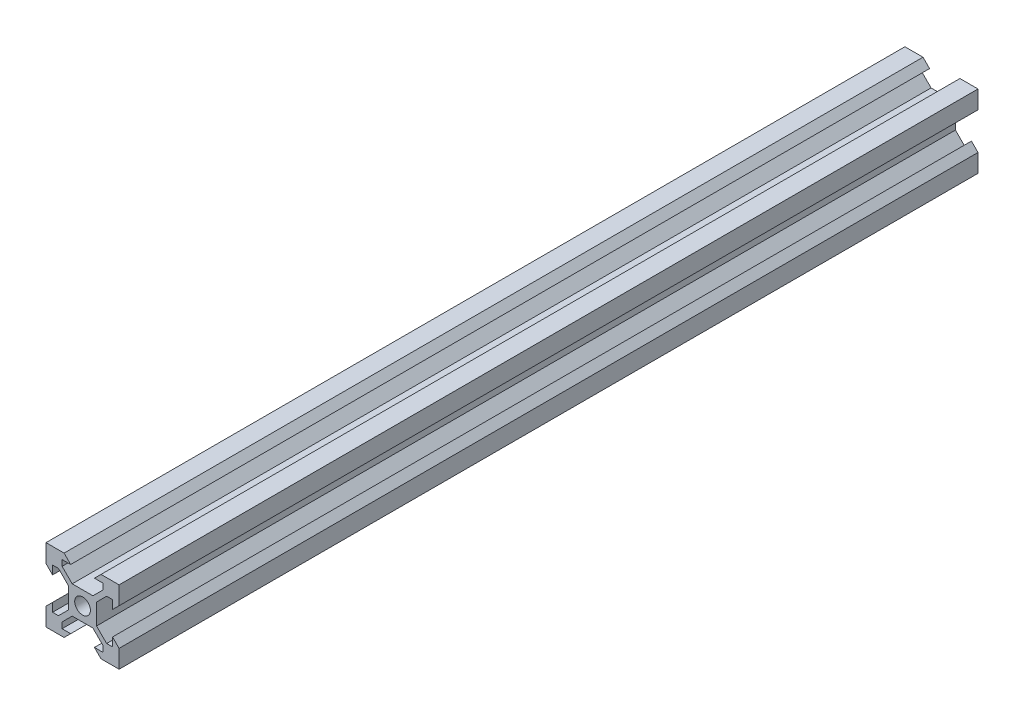
from build123d import *

# Parameters (mm, degrees)
CROQUIS1_R      = 2.15
BOSCHBASE_DEPTH = 235


with BuildPart() as part:
    # Croquis1 → BoschBase (new body)
    with BuildSketch(Plane.XY):
        Polygon((4.4, 0), (0, 0), (0, -0.56736664), (0, -4.4), (0, -4.95), (1.8, -6.75), (1.8, -4.4), (3.410050506, -4.4), (6.175, -7.164949494), (6.175, -12.835050506), (3.410050506, -15.6), (1.8, -15.6), (1.8, -13.25), (0, -15.05), (0, -15.6), (0, -20), (4.4, -20), (4.95, -20), (6.75, -18.2), (4.4, -18.2), (4.4, -16.589949494), (7.164949494, -13.825), (12.835050506, -13.825), (15.6, -16.589949494), (15.6, -18.2), (13.25, -18.2), (15.05, -20), (15.6, -20), (18.2, -20), (20, -20), (20, -15.6), (20, -15.05), (18.2, -13.25), (18.2, -15.6), (16.589949494, -15.6), (13.825, -12.835050506), (13.825, -7.164949494), (16.589949494, -4.4), (18.2, -4.4), (18.2, -6.75), (20, -4.95), (20, -4.4), (20, 0), (15.6, 0), (15.05, 0), (13.25, -1.8), (15.6, -1.8), (15.6, -3.410050506), (12.835050506, -6.175), (7.164949494, -6.175), (4.4, -3.410050506), (4.4, -1.8), (6.75, -1.8), (4.95, 0), align=None)
        with Locations(Location((10, -10, 0), (0, 0, 180))):
            Circle(CROQUIS1_R, mode=Mode.SUBTRACT)
    extrude(amount=BOSCHBASE_DEPTH)


solid = part.part
